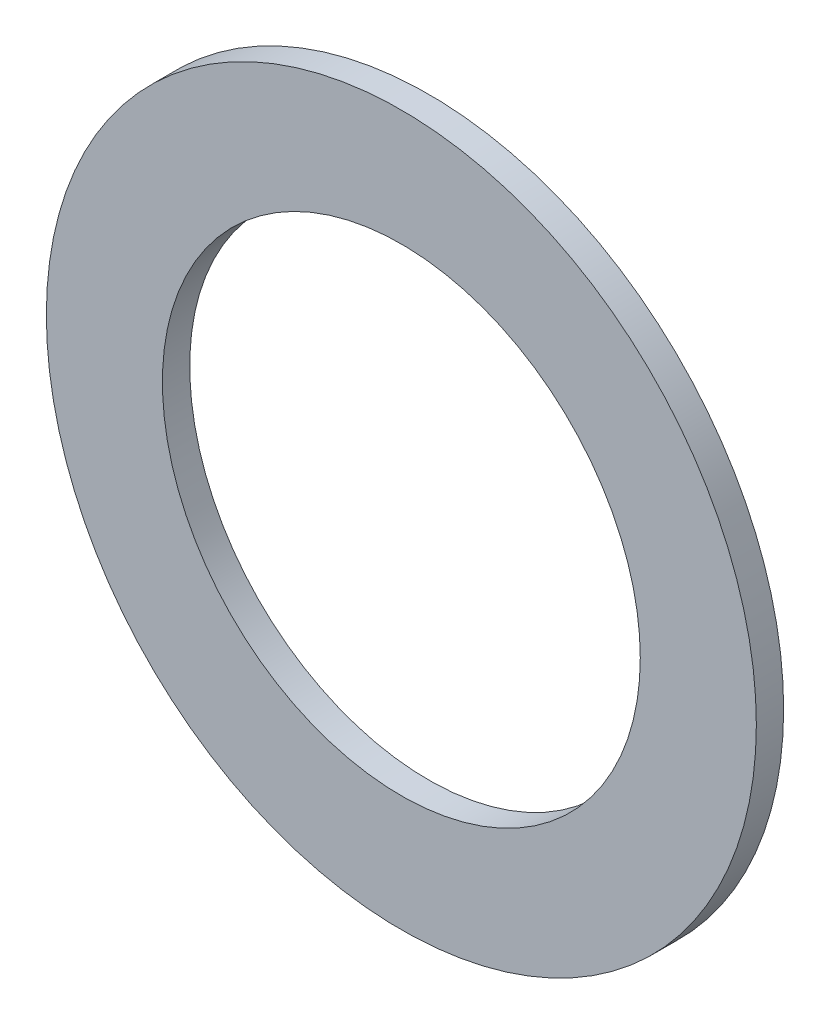
from build123d import *

# Parameters (mm, degrees)
SKETCH_1_R      = 26
SKETCH_1_R_2    = 17.5
EXTRUDE_1_DEPTH = 2


with BuildPart() as part:
    # 草图1 → 凸台-拉伸1 (new body)
    with BuildSketch(Plane.XY):
        Circle(SKETCH_1_R)
        Circle(SKETCH_1_R_2, mode=Mode.SUBTRACT)
    extrude(amount=EXTRUDE_1_DEPTH)


solid = part.part
